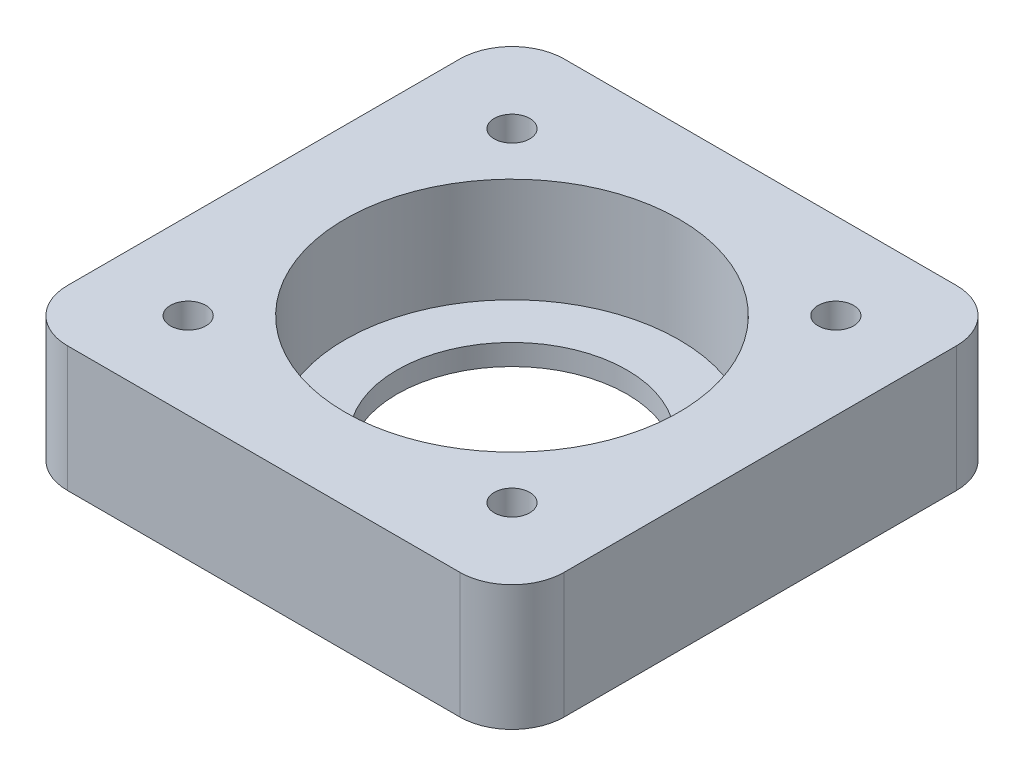
from build123d import *

# Parameters (mm, degrees)
SKETCH1_W           = 47.55
SKETCH1_H           = 47.55
SKETCH1_R           = 1.7
SKETCH1_R_2         = 16
BOSS_EXTRUDE1_DEPTH = 12
SKETCH2_R           = 16
SKETCH2_R_2         = 11
BOSS_EXTRUDE2_DEPTH = 2
FILLET1_R           = 5


with BuildPart() as part:
    # Sketch1 → Boss-Extrude1 (new body)
    with BuildSketch(Plane(origin=(0, 0, 0), x_dir=(1, 0, 0), z_dir=(0, 1, 0))):
        Rectangle(SKETCH1_W, SKETCH1_H)
        with Locations(Location((-15.5, 15.5, 0), (0, 0, 270))):
            Circle(SKETCH1_R, mode=Mode.SUBTRACT)
        with Locations(Location((15.5, 15.5, 0), (0, 0, 270))):
            Circle(SKETCH1_R, mode=Mode.SUBTRACT)
        with Locations(Location((15.5, -15.5, 0), (0, 0, 270))):
            Circle(SKETCH1_R, mode=Mode.SUBTRACT)
        with Locations(Location((-15.5, -15.5, 0), (0, 0, 270))):
            Circle(SKETCH1_R, mode=Mode.SUBTRACT)
        with Locations(Location((0, 0, 0), (0, 0, 270))):
            Circle(SKETCH1_R_2, mode=Mode.SUBTRACT)
    extrude(amount=BOSS_EXTRUDE1_DEPTH)

    # Sketch2 → Boss-Extrude2 (add)
    with BuildSketch(Plane.XZ):
        with Locations(Location((0, 0, 0), (0, 0, 270))):
            Circle(SKETCH2_R)
        with Locations(Location((0, 0, 0), (0, 0, 270))):
            Circle(SKETCH2_R_2, mode=Mode.SUBTRACT)
    extrude(amount=-BOSS_EXTRUDE2_DEPTH)

    # Fillet1
    fillet1_edges = [part.edges().sort_by_distance(p)[0] for p in [
        (23.775, 6, 23.775),
        (-23.775, 6, 23.775),
        (-23.775, 6, -23.775),
        (23.775, 6, -23.775),
    ]]
    fillet(fillet1_edges, radius=FILLET1_R)


solid = part.part
